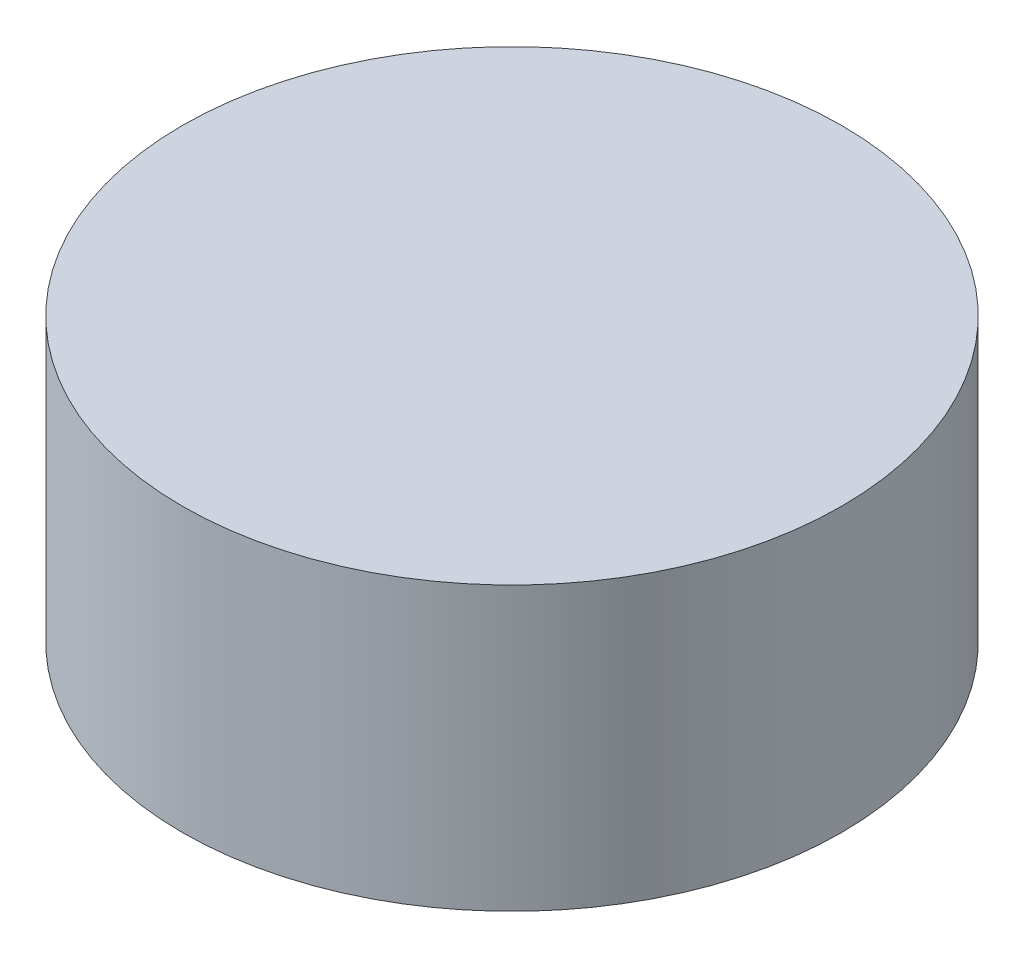
from build123d import *

# Parameters (mm, degrees)
SKETCH_1_W = 3.5
SKETCH_1_H = 3


with BuildPart() as part:
    # 草图1 → Revolve 2 (revolve)
    with BuildSketch(Plane.XY, mode=Mode.PRIVATE) as revolve_2_sk:
        with Locations((1.75, 1.5)):
            Rectangle(SKETCH_1_W, SKETCH_1_H)
    revolve(revolve_2_sk.sketch.rotate(Axis((0, 0, 0), (0, 1, 0)), 90), axis=Axis((0, 0, 0), (0, 1, 0)))


solid = part.part
